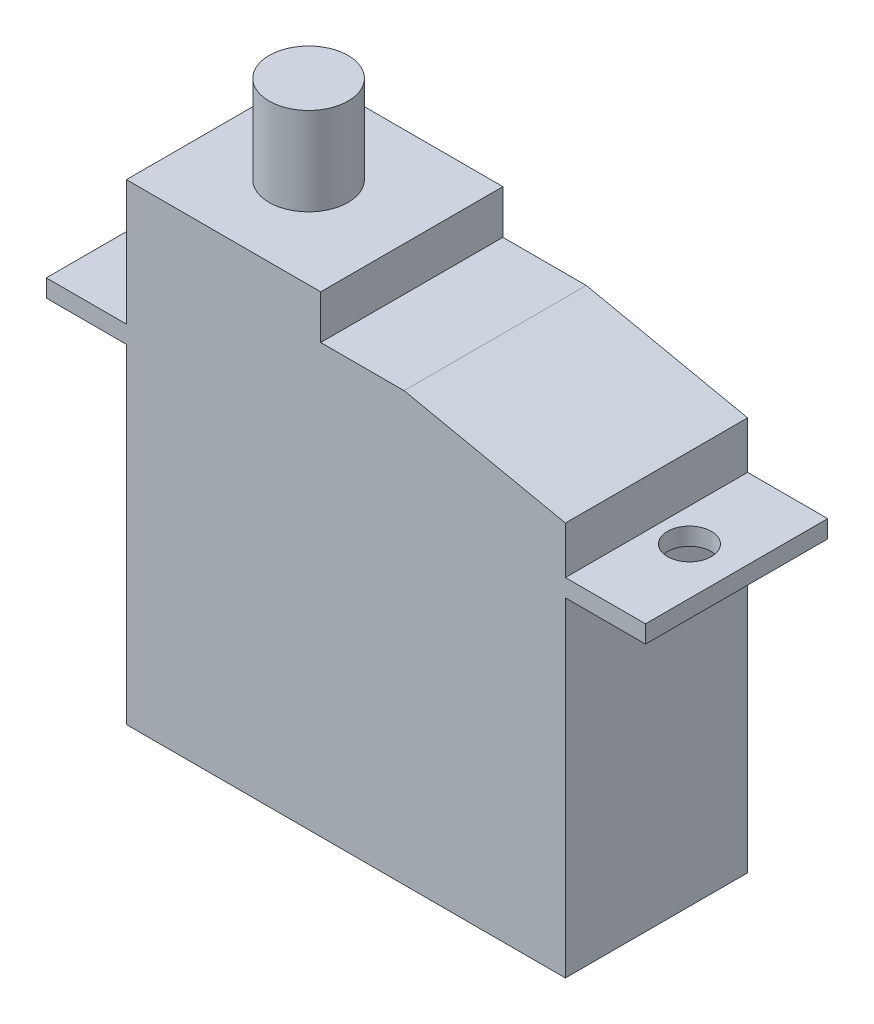
from build123d import *

# Parameters (mm, degrees)
EXTRUDE_1_DEPTH     = 4.15
SKETCH_2_W          = 27.3
SKETCH_2_H          = 0.8
EXTRUDE_2_DEPTH     = 8.3
CUT_EXTRUDE_1_REACH = 30.743
SKETCH_3_R          = 1
SKETCH_4_R          = 1.8
EXTRUDE_3_DEPTH     = 4


with BuildPart() as part:
    # 草图1 → 凸台-拉伸1 (new, symmetric)
    with BuildSketch(Plane.XY):
        Polygon((12.649672005, 19.5), (20, 17.950931016), (20, 0), (0, 0), (0, 16.33633198), (0, 21.5), (8.852277233, 21.5), (8.852277233, 19.5), align=None)
    extrude(amount=EXTRUDE_1_DEPTH, both=True)

    # 草图2 → 凸台-拉伸2 (add)
    with BuildSketch(Plane.XY.offset(4.15)):
        with Locations((10, 15.4)):
            Rectangle(SKETCH_2_W, SKETCH_2_H)
    extrude(amount=-EXTRUDE_2_DEPTH)

    # 草图3 → 切除-拉伸1 (cut, up to next)
    with BuildSketch(Plane(origin=(0, 15.8, 0), x_dir=(1, 0, 0), z_dir=(0, 1, 0)), mode=Mode.PRIVATE) as cut_extrude_1_sk1:
        with Locations((-1.5, 0)):
            Circle(SKETCH_3_R)
    cut_extrude_1_tool1 = extrude(cut_extrude_1_sk1.sketch, amount=-CUT_EXTRUDE_1_REACH, mode=Mode.PRIVATE) & part.part
    # 草图3 → 切除-拉伸1 (cut, up to next)
    with BuildSketch(Plane(origin=(0, 15.8, 0), x_dir=(1, 0, 0), z_dir=(0, 1, 0)), mode=Mode.PRIVATE) as cut_extrude_1_sk2:
        with Locations((21.5, 0)):
            Circle(SKETCH_3_R)
    cut_extrude_1_tool2 = extrude(cut_extrude_1_sk2.sketch, amount=-CUT_EXTRUDE_1_REACH, mode=Mode.PRIVATE) & part.part
    add(cut_extrude_1_tool1.solids().sort_by_distance((-1.5, 15.8, 0))[0], mode=Mode.SUBTRACT)
    add(cut_extrude_1_tool2.solids().sort_by_distance((21.5, 15.8, 0))[0], mode=Mode.SUBTRACT)

    # 草图4 → 凸台-拉伸3 (add)
    with BuildSketch(Plane(origin=(0, 21.5, 0), x_dir=(1, 0, 0), z_dir=(0, 1, 0))):
        with Locations((4.15, 0)):
            Circle(SKETCH_4_R)
    extrude(amount=EXTRUDE_3_DEPTH)


solid = part.part
